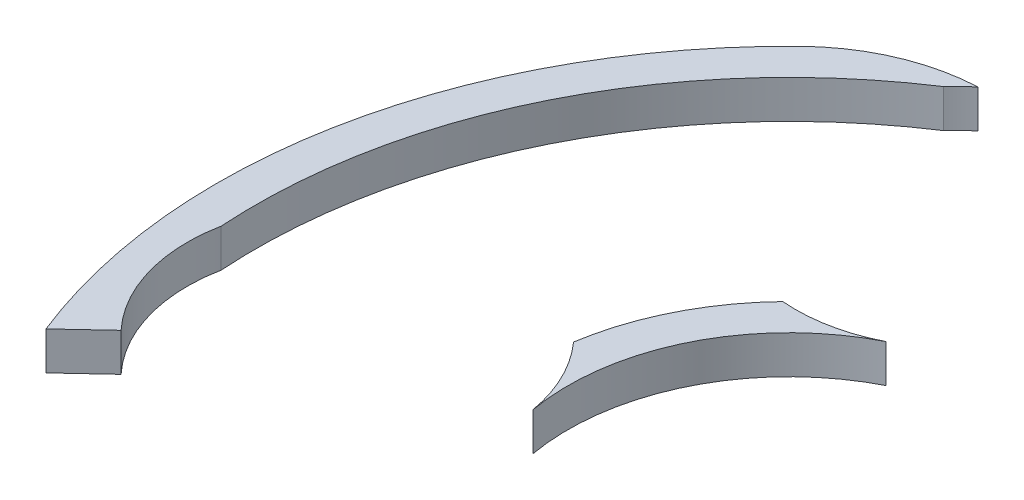
from build123d import *

# Parameters (mm, degrees)
BOSS_EXTRU_1_DEPTH   = 5
BOSS_EXTRU_1_2_DEPTH = 5


with BuildPart() as part:
    # Esquisse1 → Boss.-Extru.1 (new body)
    with BuildSketch(Plane(origin=(0, 0, 0), x_dir=(1, 0, 0), z_dir=(0, 1, 0))):
        with BuildLine():
            ThreePointArc((-68.670306383, 42.279177512), (-89.686909751, 4.154853404), (-85.986425434, -39.22103992))
            Line((-85.986425434, -39.22103992), (-80.900990435, -34.464540644))
            ThreePointArc((-80.900990435, -34.464540644), (-85.751719928, -25.903787737), (-86.17049139, -16.073187685))
            ThreePointArc((-86.17049139, -16.073187685), (-78.973775537, 19.793847734), (-54.666943907, 47.13273734))
            ThreePointArc((-54.666943907, 47.13273734), (-53.551106318, 48.285581279), (-52.350511604, 49.349872124))
            ThreePointArc((-52.350511604, 49.349872124), (-61.160452612, 47.314883556), (-68.670306383, 42.279177512))
        make_face()
    extrude(amount=BOSS_EXTRU_1_DEPTH)


with BuildPart() as body_2:
    # Esquisse1 → Boss.-Extru.1 2 (new body)
    with BuildSketch(Plane(origin=(0, 0, 0), x_dir=(1, 0, 0), z_dir=(0, 1, 0))):
        with BuildLine():
            ThreePointArc((-40.780479115, 12.187773174), (-46.754151205, 3.734713014), (-49.907579974, -6.124032915))
            ThreePointArc((-49.907579974, -6.124032915), (-46.673295144, -10.946787783), (-44.883425416, -16.470910269))
            ThreePointArc((-44.883425416, -16.470910269), (-42.279203381, 1.504277637), (-29.4940321, 14.405004281))
            ThreePointArc((-29.4940321, 14.405004281), (-34.982493838, 12.508599622), (-40.780479115, 12.187773174))
        make_face()
    extrude(amount=BOSS_EXTRU_1_2_DEPTH)


solid = Compound([part.part, body_2.part])
